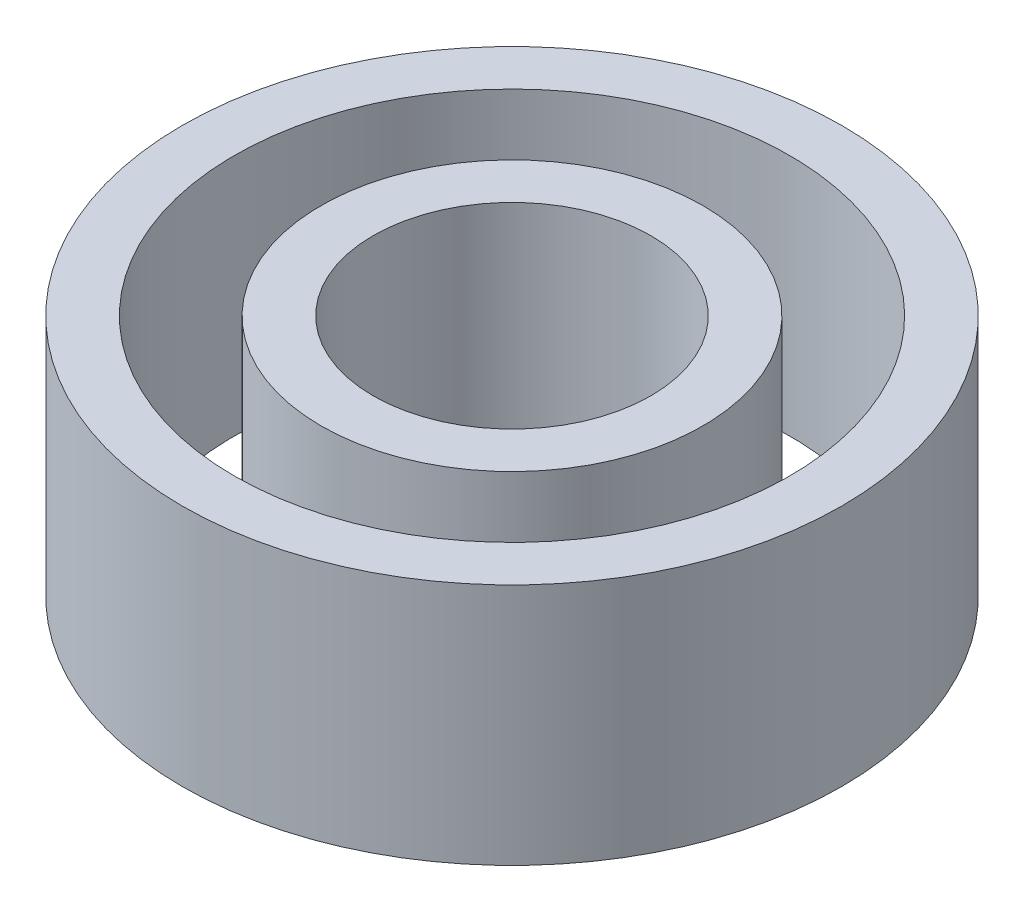
from build123d import *

# Parameters (mm, degrees)
SKETCH1_R             = 5.5
SKETCH1_R_2           = 4
BOSS_EXTRUDE1_DEPTH   = 7
SKETCH1_R_3           = 9.5
SKETCH1_R_4           = 8
BOSS_EXTRUDE1_2_DEPTH = 7


with BuildPart() as part:
    # Sketch1 → Boss-Extrude1 (new body)
    with BuildSketch(Plane(origin=(0, 0, 0), x_dir=(1, 0, 0), z_dir=(0, 1, 0))):
        with Locations(Location((0, 0, 0), (0, 0, 270))):
            Circle(SKETCH1_R)
        with Locations(Location((0, 0, 0), (0, 0, 270))):
            Circle(SKETCH1_R_2, mode=Mode.SUBTRACT)
    extrude(amount=BOSS_EXTRUDE1_DEPTH)


with BuildPart() as body_2:
    # Sketch1 → Boss-Extrude1 2 (new body)
    with BuildSketch(Plane(origin=(0, 0, 0), x_dir=(1, 0, 0), z_dir=(0, 1, 0))):
        with Locations(Location((0, 0, 0), (0, 0, 270))):
            Circle(SKETCH1_R_3)
        with Locations(Location((0, 0, 0), (0, 0, 270))):
            Circle(SKETCH1_R_4, mode=Mode.SUBTRACT)
    extrude(amount=BOSS_EXTRUDE1_2_DEPTH)


solid = Compound([part.part, body_2.part])
